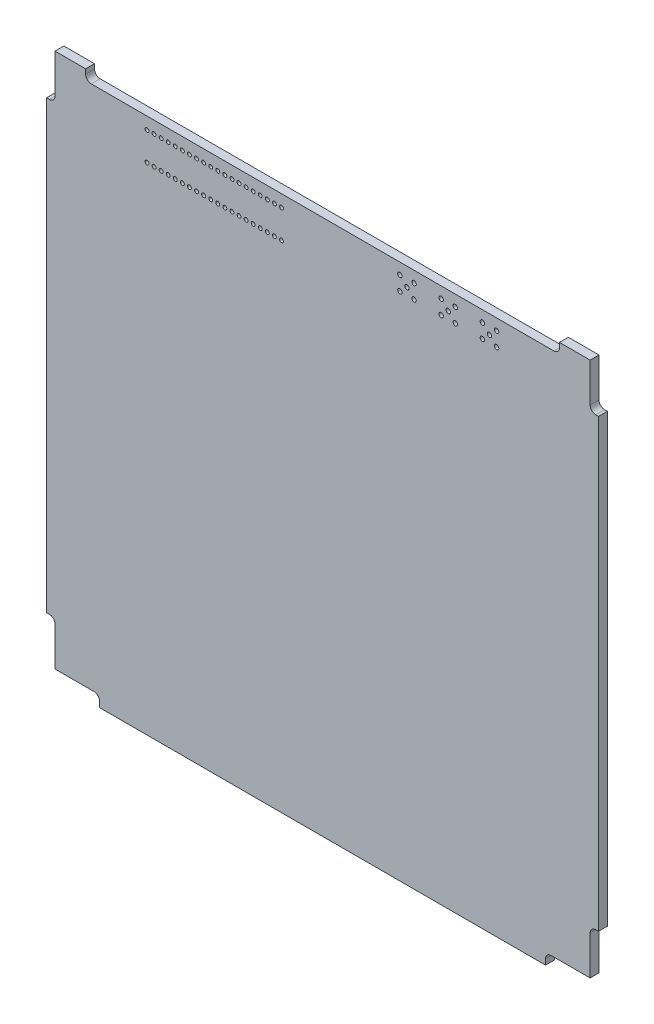
from build123d import *

# Parameters (mm, degrees)
BOSS_EXTRUDE1_DEPTH = 1.5875
SKETCH2_R           = 0.35
CUT_EXTRUDE1_DEPTH  = 71.728496069
CUT_EXTRUDE2_DEPTH  = 3.8375
FILLET2_R           = 1
SKETCH5_OUTSIDE_W   = 130.286
SKETCH5_OUTSIDE_H   = 130.286
SKETCH5_OUTSIDE_W_2 = 99
SKETCH5_OUTSIDE_H_2 = 100
CUT_EXTRUDE3_DEPTH  = 71.728496069
SKETCH8_W           = 85
SKETCH8_H           = 1.5875
CUT_EXTRUDE4_DEPTH  = 3.8375
FILLET1_R           = 1
SKETCH6_R           = 0.4
CUT_EXTRUDE5_DEPTH  = 71.375920287


with BuildPart() as part:
    # Sketch1 → Boss-Extrude1 (new body)
    with BuildSketch(Plane.XY):
        Polygon((40, 50), (-40, 50), (-40, 48), (-48, 48), (-48, 40), (-50, 40), (-50, -37.864895224), (-50, -40), (-48, -40), (-48, -48), (-40, -48), (-40, -50), (-37.864895224, -50), (40, -50), (40, -48), (48, -48), (48, -40), (50, -40), (50, 40), (48, 40), (48, 48), (40, 48), align=None)
    extrude(amount=BOSS_EXTRUDE1_DEPTH)

    # Sketch2 → Cut-Extrude1 (cut, through all)
    with BuildSketch(Plane.XY.offset(1.5875)):
        with Locations((-31.5, 44)):
            Circle(SKETCH2_R)
        with Locations((-30.23, 44)):
            Circle(SKETCH2_R)
        with Locations((-28.96, 44)):
            Circle(SKETCH2_R)
        with Locations((-27.69, 44)):
            Circle(SKETCH2_R)
        with Locations((-26.42, 44)):
            Circle(SKETCH2_R)
        with Locations((-25.15, 44)):
            Circle(SKETCH2_R)
        with Locations((-23.88, 44)):
            Circle(SKETCH2_R)
        with Locations((-22.61, 44)):
            Circle(SKETCH2_R)
        with Locations((-21.34, 44)):
            Circle(SKETCH2_R)
        with Locations((-20.07, 44)):
            Circle(SKETCH2_R)
        with Locations((-18.8, 44)):
            Circle(SKETCH2_R)
        with Locations((-17.53, 44)):
            Circle(SKETCH2_R)
        with Locations((-16.26, 44)):
            Circle(SKETCH2_R)
        with Locations((-14.99, 44)):
            Circle(SKETCH2_R)
        with Locations((-13.72, 44)):
            Circle(SKETCH2_R)
        with Locations((-12.45, 44)):
            Circle(SKETCH2_R)
        with Locations((-11.18, 44)):
            Circle(SKETCH2_R)
        with Locations((-9.91, 44)):
            Circle(SKETCH2_R)
        with Locations((-8.64, 44)):
            Circle(SKETCH2_R)
        with Locations((-7.37, 44)):
            Circle(SKETCH2_R)
        with Locations((-30.23, 38.92)):
            Circle(SKETCH2_R)
        with Locations((-28.96, 38.92)):
            Circle(SKETCH2_R)
        with Locations((-27.69, 38.92)):
            Circle(SKETCH2_R)
        with Locations((-26.42, 38.92)):
            Circle(SKETCH2_R)
        with Locations((-25.15, 38.92)):
            Circle(SKETCH2_R)
        with Locations((-23.88, 38.92)):
            Circle(SKETCH2_R)
        with Locations((-22.61, 38.92)):
            Circle(SKETCH2_R)
        with Locations((-21.34, 38.92)):
            Circle(SKETCH2_R)
        with Locations((-20.07, 38.92)):
            Circle(SKETCH2_R)
        with Locations((-18.8, 38.92)):
            Circle(SKETCH2_R)
        with Locations((-17.53, 38.92)):
            Circle(SKETCH2_R)
        with Locations((-16.26, 38.92)):
            Circle(SKETCH2_R)
        with Locations((-14.99, 38.92)):
            Circle(SKETCH2_R)
        with Locations((-13.72, 38.92)):
            Circle(SKETCH2_R)
        with Locations((-12.45, 38.92)):
            Circle(SKETCH2_R)
        with Locations((-11.18, 38.92)):
            Circle(SKETCH2_R)
        with Locations((-9.91, 38.92)):
            Circle(SKETCH2_R)
        with Locations((-8.64, 38.92)):
            Circle(SKETCH2_R)
        with Locations((-7.37, 38.92)):
            Circle(SKETCH2_R)
        with Locations((-31.5, 38.92)):
            Circle(SKETCH2_R)
    extrude(amount=-CUT_EXTRUDE1_DEPTH, mode=Mode.SUBTRACT)

    # Sketch3 → Cut-Extrude2 (cut)
    with BuildSketch(Plane(origin=(0, 50, 0), x_dir=(1, 0, 0), z_dir=(0, 1, 0))):
        Polygon((10.7, 0), (19.7, 0), (34.5, 0), (34.5, -1.5875), (19.7, -1.5875), (10.7, -1.5875), align=None)
    extrude(amount=-CUT_EXTRUDE2_DEPTH, mode=Mode.SUBTRACT)

    # Fillet2
    fillet2_edges = [part.edges().sort_by_distance(p)[0] for p in [
        (10.7, 46.1625, 0.79375),
        (34.5, 46.1625, 0.79375),
    ]]
    fillet(fillet2_edges, radius=FILLET2_R)

    # Sketch5 outside → Cut-Extrude3 (cut, through all)
    with BuildSketch(Plane(origin=(0, 0, 0), x_dir=(-1, 0, 0), z_dir=(0, 0, -1))):
        Rectangle(SKETCH5_OUTSIDE_W, SKETCH5_OUTSIDE_H)
        Rectangle(SKETCH5_OUTSIDE_W_2, SKETCH5_OUTSIDE_H_2, mode=Mode.SUBTRACT)
    extrude(amount=-CUT_EXTRUDE3_DEPTH, mode=Mode.SUBTRACT)

    # Sketch8 → Cut-Extrude4 (cut)
    with BuildSketch(Plane(origin=(0, 50, 0), x_dir=(1, 0, 0), z_dir=(0, 1, 0))):
        with Locations((0, -0.79375)):
            Rectangle(SKETCH8_W, SKETCH8_H)
    extrude(amount=-CUT_EXTRUDE4_DEPTH, mode=Mode.SUBTRACT)

    # Fillet1
    fillet1_edges = [part.edges().sort_by_distance(p)[0] for p in [
        (42.5, 46.1625, 0.79375),
        (-42.5, 46.1625, 0.79375),
        (-48, -40, 0.79375),
        (-48, 40, 0.79375),
        (48, 40, 0.79375),
        (48, -40, 0.79375),
        (40, -48, 0.79375),
        (-40, -48, 0.79375),
    ]]
    fillet(fillet1_edges, radius=FILLET1_R)

    # Sketch6 → Cut-Extrude5 (cut, through all)
    with BuildSketch(Plane.XY.offset(1.5875)):
        with Locations((29.94, 42.8925)):
            Circle(SKETCH6_R)
        with Locations((28.67, 44.1625)):
            Circle(SKETCH6_R)
        with Locations((31.21, 44.1625)):
            Circle(SKETCH6_R)
        with Locations((31.21, 41.6225)):
            Circle(SKETCH6_R)
        with Locations((28.67, 41.6225)):
            Circle(SKETCH6_R)
        with Locations((22.54, 42.8925)):
            Circle(SKETCH6_R)
        with Locations((21.27, 44.1625)):
            Circle(SKETCH6_R)
        with Locations((23.81, 44.1625)):
            Circle(SKETCH6_R)
        with Locations((23.81, 41.6225)):
            Circle(SKETCH6_R)
        with Locations((21.27, 41.6225)):
            Circle(SKETCH6_R)
        with Locations((15.14, 42.8925)):
            Circle(SKETCH6_R)
        with Locations((13.87, 44.1625)):
            Circle(SKETCH6_R)
        with Locations((16.41, 44.1625)):
            Circle(SKETCH6_R)
        with Locations((16.41, 41.6225)):
            Circle(SKETCH6_R)
        with Locations((13.87, 41.6225)):
            Circle(SKETCH6_R)
    extrude(amount=-CUT_EXTRUDE5_DEPTH, mode=Mode.SUBTRACT)


solid = part.part
